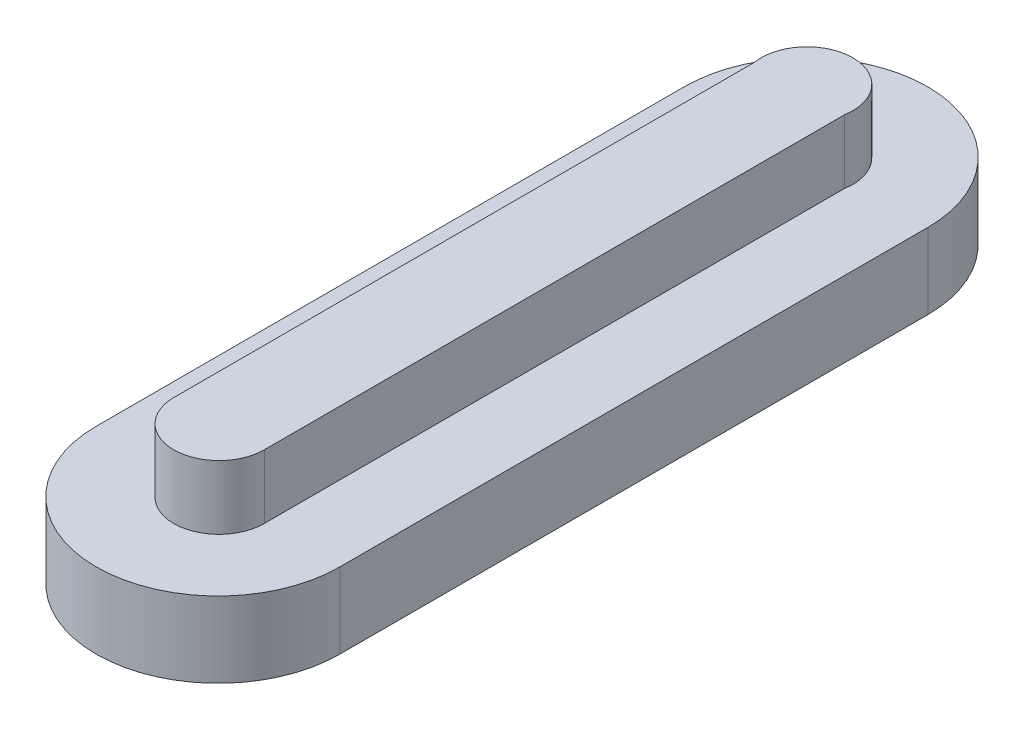
from build123d import *

# Parameters (mm, degrees)
BOSS_EXTRUDE1_DEPTH = 4.5
BOSS_EXTRUDE2_DEPTH = 3.8
BOSS_EXTRUDE3_DEPTH = 8.1
CUT_EXTRUDE2_START  = -8.1
CUT_EXTRUDE2_DEPTH  = 8.1


with BuildPart() as part:
    # Sketch1 → Boss-Extrude1 (new body)
    with BuildSketch(Plane(origin=(0, 0, 0), x_dir=(1, 0, 0), z_dir=(0, 1, 0))):
        with BuildLine():
            Line((7.25, 0), (7.25, -35))
            ThreePointArc((7.25, -35), (0, -42.25), (-7.25, -35))
            Line((-7.25, -35), (-7.25, 0))
            ThreePointArc((-7.25, 0), (0, 7.25), (7.25, 0))
        make_face()
    extrude(amount=BOSS_EXTRUDE1_DEPTH)

    # Sketch3 → Boss-Extrude2 (add)
    with BuildSketch(Plane(origin=(0, 4.5, 0), x_dir=(1, 0, 0), z_dir=(0, 1, 0))):
        with BuildLine():
            Line((-2.622571491, -0.457666807), (-2.622571491, -0.011296081))
            Line((-2.622571491, -0.011296081), (2.763792269, -0.011296081))
            Line((2.763792269, -0.011296081), (2.763792269, -0.457666807))
            ThreePointArc((2.763792269, -0.457666807), (2.791332039, -0.235236185), (2.800532634, -0.011296081))
            ThreePointArc((2.800532634, -0.011296081), (-0.153329714, 2.709425568), (-2.622571491, -0.457666807))
        make_face()
        with BuildLine():
            Line((2.763792269, -0.011296081), (-2.622571491, -0.011296081))
            Line((-2.622571491, -0.011296081), (-2.622571491, -0.457666807))
            ThreePointArc((-2.622571491, -0.457666807), (0.070610389, -2.741218326), (2.763792269, -0.457666807))
            Line((2.763792269, -0.457666807), (2.763792269, -0.011296081))
        make_face()
        with BuildLine():
            ThreePointArc((2.763792269, -0.457666807), (0.070610389, -2.741218326), (-2.622571491, -0.457666807))
            Line((-2.622571491, -0.457666807), (-2.622571491, -35.011296081))
            ThreePointArc((-2.622571491, -35.011296081), (0.070610389, -32.318114201), (2.763792269, -35.011296081))
            Line((2.763792269, -35.011296081), (2.763792269, -0.457666807))
        make_face()
        with BuildLine():
            ThreePointArc((2.763792269, -35.011296081), (0.070610389, -32.318114201), (-2.622571491, -35.011296081))
            Line((-2.622571491, -35.011296081), (2.763792269, -35.011296081))
        make_face()
        with BuildLine():
            Line((2.763792269, -35.011296081), (-2.622571491, -35.011296081))
            ThreePointArc((-2.622571491, -35.011296081), (0.070610389, -37.704477961), (2.763792269, -35.011296081))
        make_face()
    extrude(amount=BOSS_EXTRUDE2_DEPTH)

    # Sketch4 → Boss-Extrude3 (add)
    with BuildSketch(Plane(origin=(0, 8.3, 0), x_dir=(1, 0, 0), z_dir=(0, 1, 0))):
        with BuildLine():
            Line((7.25308141, 0.014627933), (7.323691799, -34.996668148))
            ThreePointArc((7.323691799, -34.996668148), (0.085238322, -42.264377491), (-7.182471021, -35.025924014))
            Line((-7.182471021, -35.025924014), (-7.25308141, -0.014627933))
            ThreePointArc((-7.25308141, -0.014627933), (-0.014627933, 7.25308141), (7.25308141, 0.014627933))
        make_face()
    extrude(amount=BOSS_EXTRUDE3_DEPTH)

    # Sketch6 → Cut-Extrude2 (cut)
    with BuildSketch(Plane(origin=(0, 16.4, 0), x_dir=(1, 0, 0), z_dir=(0, 1, 0)).offset(CUT_EXTRUDE2_START)):
        with BuildLine():
            Line((-24.579752733, 25.941605668), (4.44385737, 25.941605668))
            Line((4.44385737, 25.941605668), (4.44385737, 5.732323751))
            ThreePointArc((4.44385737, 5.732323751), (6.509808413, 3.198405594), (7.25308141, 0.014627933))
            Line((7.25308141, 0.014627933), (7.323691799, -34.996668148))
            ThreePointArc((7.323691799, -34.996668148), (6.567208075, -38.236450718), (4.44385737, -40.797669277))
            Line((4.44385737, -40.797669277), (4.44385737, -52.11567356))
            Line((4.44385737, -52.11567356), (-24.579752733, -52.11567356))
            Line((-24.579752733, -52.11567356), (-24.579752733, -65.847384837))
            Line((-24.579752733, -65.847384837), (23.383123672, -65.847384837))
            Line((23.383123672, -65.847384837), (23.383123672, 36.458721402))
            Line((23.383123672, 36.458721402), (-24.579752733, 36.458721402))
            Line((-24.579752733, 36.458721402), (-24.579752733, 25.941605668))
        make_face()
        with BuildLine():
            Line((4.44385737, 5.732323751), (4.44385737, 25.941605668))
            Line((4.44385737, 25.941605668), (-24.579752733, 25.941605668))
            Line((-24.579752733, 25.941605668), (-24.579752733, -52.11567356))
            Line((-24.579752733, -52.11567356), (4.44385737, -52.11567356))
            Line((4.44385737, -52.11567356), (4.44385737, -40.797669277))
            ThreePointArc((4.44385737, -40.797669277), (-3.154544247, -41.507893767), (-7.182471021, -35.025924014))
            Line((-7.182471021, -35.025924014), (-7.25308141, -0.014627933))
            ThreePointArc((-7.25308141, -0.014627933), (-3.198405594, 6.509808413), (4.44385737, 5.732323751))
        make_face()
        with BuildLine():
            Line((4.44385737, -40.797669277), (4.44385737, 5.732323751))
            ThreePointArc((4.44385737, 5.732323751), (-3.198405594, 6.509808413), (-7.25308141, -0.014627933))
            Line((-7.25308141, -0.014627933), (-7.182471021, -35.025924014))
            ThreePointArc((-7.182471021, -35.025924014), (-3.154544247, -41.507893767), (4.44385737, -40.797669277))
        make_face()
        with BuildLine():
            ThreePointArc((7.25308141, 0.014627933), (6.509808413, 3.198405594), (4.44385737, 5.732323751))
            Line((4.44385737, 5.732323751), (4.44385737, -40.797669277))
            ThreePointArc((4.44385737, -40.797669277), (6.567208075, -38.236450718), (7.323691799, -34.996668148))
            Line((7.323691799, -34.996668148), (7.25308141, 0.014627933))
        make_face()
    extrude(amount=CUT_EXTRUDE2_DEPTH, mode=Mode.SUBTRACT)


solid = part.part
